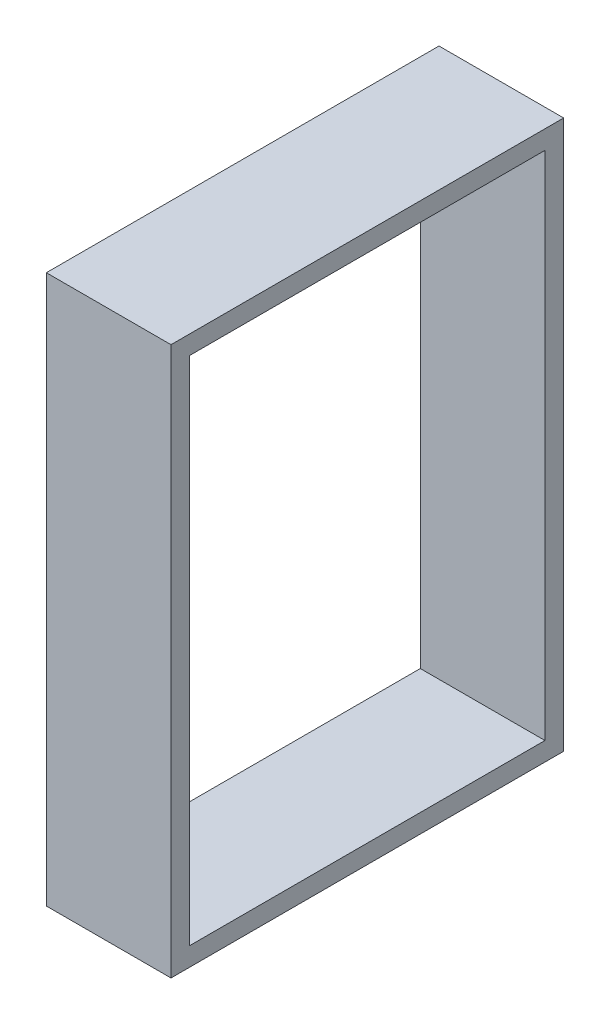
from build123d import *

# Parameters (mm, degrees)
MAIN_PROFILE_SKETCH_W   = 31.5
MAIN_PROFILE_SKETCH_H   = 44
MAIN_PROFILE_SKETCH_W_2 = 28.5
MAIN_PROFILE_SKETCH_H_2 = 41
MAIN_EXTRUSION_DEPTH    = 10


with BuildPart() as part:
    # Main Profile Sketch → Main Extrusion (new body)
    with BuildSketch(Plane(origin=(-240, 0, 0), x_dir=(0, 0, -1), z_dir=(1, 0, 0))):
        with Locations((-64.25, -26.5)):
            Rectangle(MAIN_PROFILE_SKETCH_W, MAIN_PROFILE_SKETCH_H)
        with Locations((-64.25, -26.5)):
            Rectangle(MAIN_PROFILE_SKETCH_W_2, MAIN_PROFILE_SKETCH_H_2, mode=Mode.SUBTRACT)
    extrude(amount=-MAIN_EXTRUSION_DEPTH)


solid = part.part
